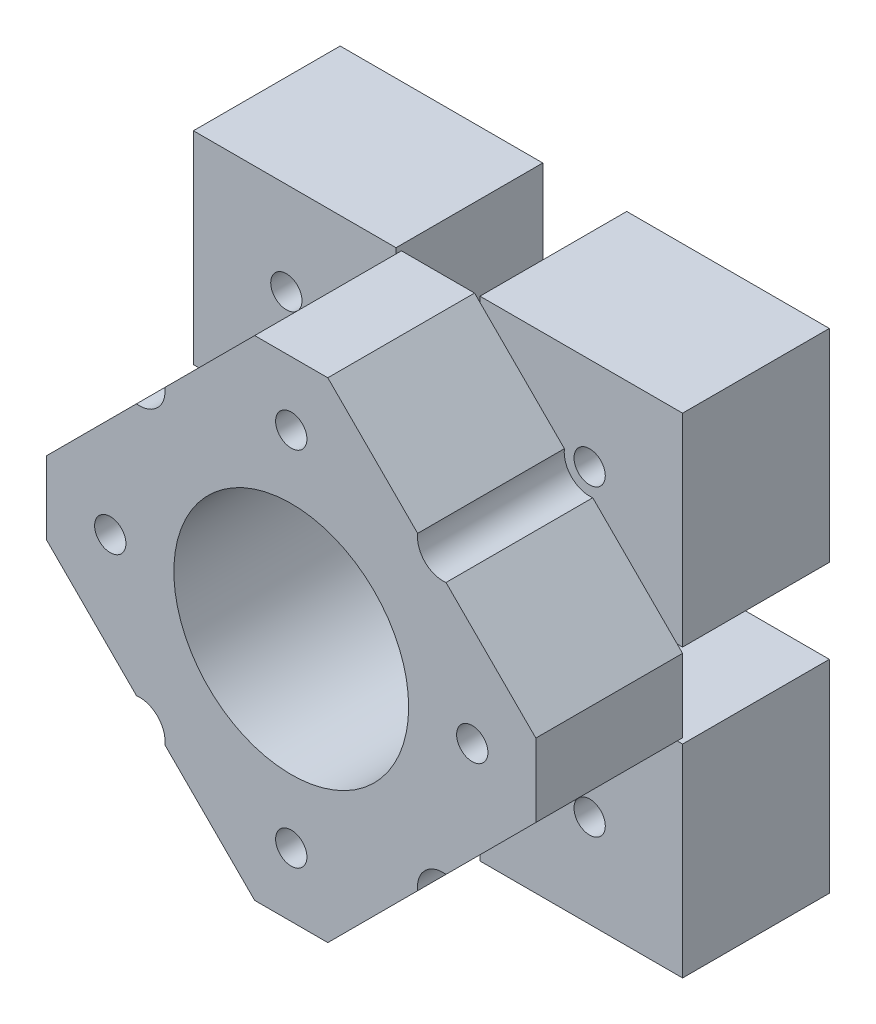
from build123d import *

# Parameters (mm, degrees)
SKETCH_1_W          = 50
SKETCH_1_H          = 50
EXTRUDE_1_DEPTH     = 30
HOLE_WIZARD_348_D   = 24
HOLE_WIZARD_1_D     = 3.2
HOLE_WIZARD_2_D     = 3.2
CUT_EXTRUDE_1_DEPTH = 15
SKETCH_16_W         = 8.580132312
SKETCH_16_H         = 9.5
SKETCH_16_W_2       = 9.5
SKETCH_16_H_2       = 8.580132312
CUT_EXTRUDE_3_DEPTH = 15
HOLE_WIZARD_3_D     = 5.2
HOLE_WIZARD_3_DEPTH = 15


with BuildPart() as part:
    # 草图1 → 凸台-拉伸1 (new body)
    with BuildSketch(Plane.XY):
        Rectangle(SKETCH_1_W, SKETCH_1_H)
    extrude(amount=EXTRUDE_1_DEPTH)

    # Hole Wizard 348 (through all)
    with Locations(Plane.XY.offset(30)):
        with Locations((0, 0)):
            Hole(HOLE_WIZARD_348_D / 2)

    # 孔1 (through all)
    with Locations(Plane.XY.offset(30)):
        with Locations((-15.5, 15.5), (15.5, 15.5), (15.5, -15.5), (-15.5, -15.5)):
            Hole(HOLE_WIZARD_1_D / 2)

    # 孔2 (through all)
    with Locations(Plane.XY.offset(30)):
        with Locations((0, 18.5), (18.5, 0), (0, -18.5), (-18.5, 0)):
            Hole(HOLE_WIZARD_2_D / 2)

    # 草图13 → 切除-拉伸-薄壁1 (cut)
    with BuildSketch(Plane.XY.offset(30)):
        Polygon((-25, 3.7372583), (-14.36862915, 14.36862915), (-3.7372583, 25), (-17.879393924, 39.142135624), (-28.510764774, 28.510764774), (-39.142135624, 17.879393924), align=None)
        Polygon((3.7372583, 25), (14.36862915, 14.36862915), (25, 3.7372583), (39.142135624, 17.879393924), (28.510764774, 28.510764774), (17.879393924, 39.142135624), align=None)
        Polygon((-3.7372583, -25), (-14.36862915, -14.36862915), (-25, -3.7372583), (-39.142135624, -17.879393924), (-28.510764774, -28.510764774), (-17.879393924, -39.142135624), align=None)
        Polygon((25, -3.7372583), (14.36862915, -14.36862915), (3.7372583, -25), (17.879393924, -39.142135624), (28.510764774, -28.510764774), (39.142135624, -17.879393924), align=None)
    extrude(amount=-CUT_EXTRUDE_1_DEPTH, mode=Mode.SUBTRACT)

    # 草图16 → 切除-拉伸3 (cut)
    with BuildSketch(Plane(origin=(0, 0, 0), x_dir=(-1, 0, 0), z_dir=(0, 0, -1))):
        with Locations((0, 20.25)):
            Rectangle(SKETCH_16_W, SKETCH_16_H)
        with Locations((0, -20.25)):
            Rectangle(SKETCH_16_W, SKETCH_16_H)
        with Locations((-20.25, 0)):
            Rectangle(SKETCH_16_W_2, SKETCH_16_H_2)
        with Locations((20.25, 0)):
            Rectangle(SKETCH_16_W_2, SKETCH_16_H_2)
    extrude(amount=-CUT_EXTRUDE_3_DEPTH, mode=Mode.SUBTRACT)

    # 孔3
    with Locations(Plane.XY.offset(30)):
        with Locations((-15.5, 15.5), (15.5, 15.5), (15.5, -15.5), (-15.5, -15.5)):
            Hole(HOLE_WIZARD_3_D / 2, depth=HOLE_WIZARD_3_DEPTH)


solid = part.part
